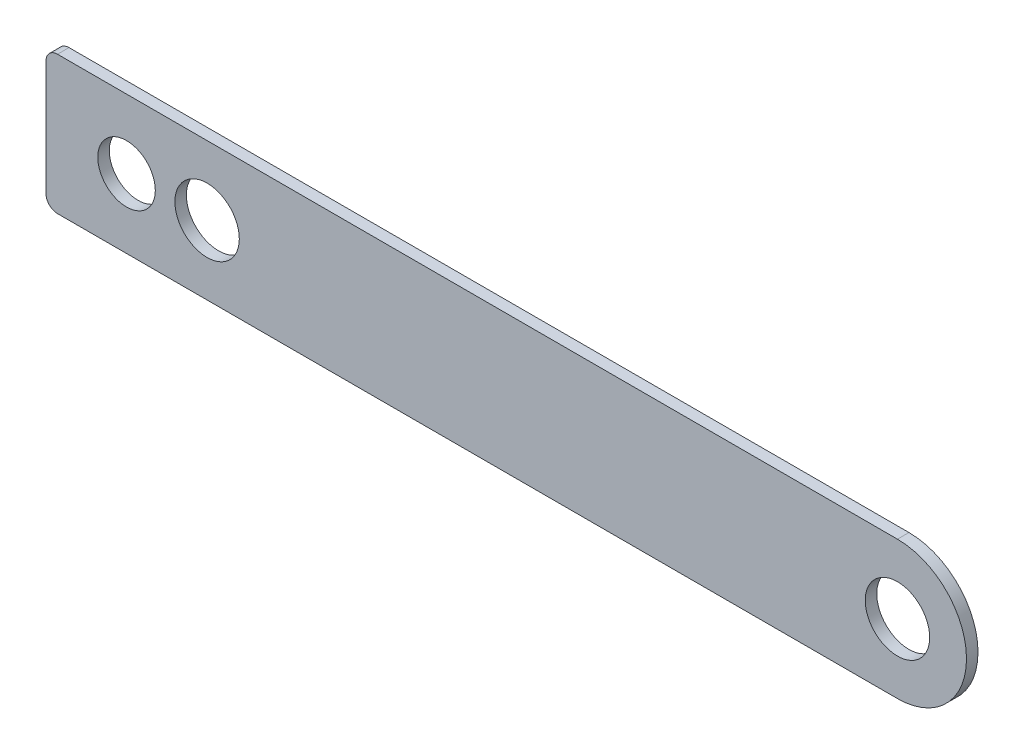
from build123d import *

# Parameters (mm, degrees)
SALIENTE_EXTRUIR1_DEPTH = 5
CROQUIS2_R              = 14
CROQUIS2_R_2            = 12.5
CORTAR_EXTRUIR1_DEPTH   = 5


with BuildPart() as part:
    # Croquis1 → Saliente-Extruir1 (new body)
    with BuildSketch(Plane.XY):
        with BuildLine():
            Line((5, 0), (370, 0))
            ThreePointArc((370, 0), (400, 30), (370, 60))
            Line((370, 60), (5, 60))
            ThreePointArc((5, 60), (1.464466094, 58.535533906), (0, 55))
            Line((0, 55), (0, 5))
            ThreePointArc((0, 5), (1.464466094, 1.464466094), (5, 0))
        make_face()
    extrude(amount=SALIENTE_EXTRUIR1_DEPTH)

    # Croquis2 → Cortar-Extruir1 (cut)
    with BuildSketch(Plane.XY.offset(5)):
        with Locations((370, 30)):
            Circle(CROQUIS2_R)
        with Locations((35, 30)):
            Circle(CROQUIS2_R_2)
        with Locations((70, 30)):
            Circle(CROQUIS2_R)
    extrude(amount=-CORTAR_EXTRUIR1_DEPTH, mode=Mode.SUBTRACT)


solid = part.part
